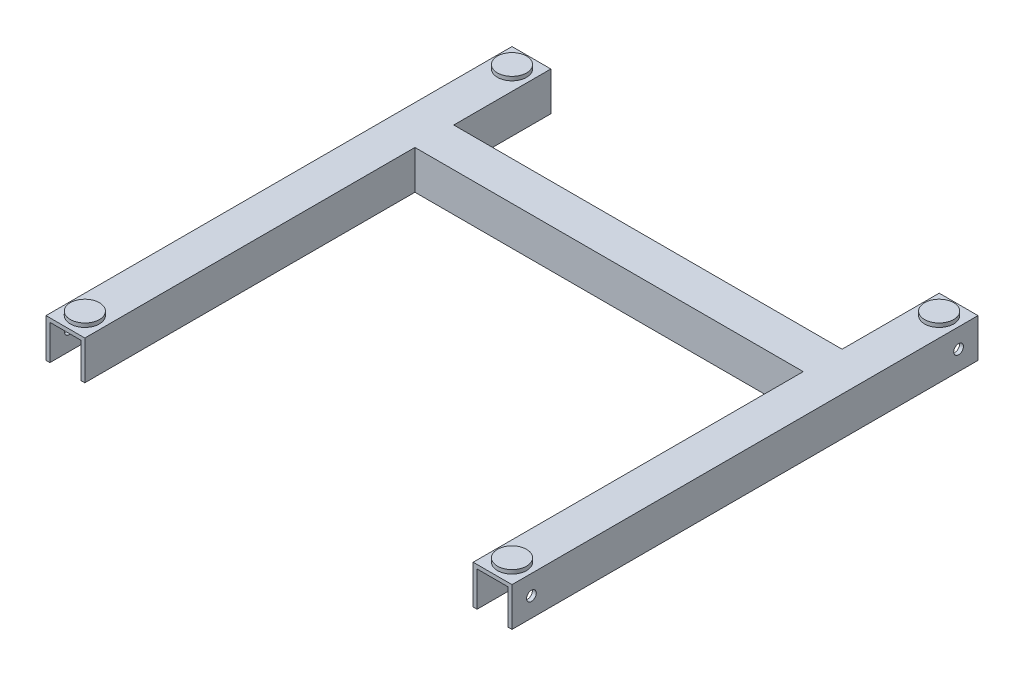
from build123d import *

# Parameters (mm, degrees)
SKETCH1_W           = 25.4
SKETCH1_H           = 304.8
BOSS_EXTRUDE1_DEPTH = 25.4
SKETCH2_W           = 20.32
SKETCH2_H           = 22.86
CUT_EXTRUDE1_DEPTH  = 307.909367729
SKETCH3_R           = 9.525
BOSS_EXTRUDE2_DEPTH = 2.54
SKETCH4_W           = 25.4
SKETCH4_H           = 25.4
BOSS_EXTRUDE3_DEPTH = 127
SKETCH5_W           = 20.32
SKETCH5_H           = 22.86
CUT_EXTRUDE2_DEPTH  = 127
SKETCH6_R           = 3.175
CUT_EXTRUDE3_DEPTH  = 12.7
CUT_EXTRUDE4_START  = -12.7
SKETCH7_R           = 3.175
CUT_EXTRUDE4_DEPTH  = 12.7


with BuildPart() as part:
    # Sketch1 → Boss-Extrude1 (new body)
    with BuildSketch(Plane(origin=(0, 0, 0), x_dir=(1, 0, 0), z_dir=(0, 1, 0))):
        with Locations((12.7, 152.4)):
            Rectangle(SKETCH1_W, SKETCH1_H)
    extrude(amount=BOSS_EXTRUDE1_DEPTH)

    # Sketch2 → Cut-Extrude1 (cut, through all)
    with BuildSketch(Plane.XY):
        with Locations((12.7, 11.43)):
            Rectangle(SKETCH2_W, SKETCH2_H)
    extrude(amount=-CUT_EXTRUDE1_DEPTH, mode=Mode.SUBTRACT)

    # Sketch3 → Boss-Extrude2 (add)
    with BuildSketch(Plane(origin=(0, 25.4, 0), x_dir=(1, 0, 0), z_dir=(0, 1, 0))):
        with Locations(Location((12.7, 12.7, 0), (0, 0, 90))):
            Circle(SKETCH3_R)
        with Locations(Location((12.7, 292.1, 0), (0, 0, 90))):
            Circle(SKETCH3_R)
    extrude(amount=BOSS_EXTRUDE2_DEPTH)

    # Sketch4 → Boss-Extrude3 (add)
    with BuildSketch(Plane(origin=(25.4, 0, 0), x_dir=(0, 0, -1), z_dir=(1, 0, 0))):
        with Locations((228.6, 12.7)):
            Rectangle(SKETCH4_W, SKETCH4_H)
    extrude(amount=BOSS_EXTRUDE3_DEPTH)

    # Sketch5 → Cut-Extrude2 (cut)
    with BuildSketch(Plane(origin=(152.4, 0, 0), x_dir=(0, 0, -1), z_dir=(1, 0, 0))):
        with Locations((228.6, 11.43)):
            Rectangle(SKETCH5_W, SKETCH5_H)
    extrude(amount=-CUT_EXTRUDE2_DEPTH, mode=Mode.SUBTRACT)

    # Mirror5: part across plane


with BuildPart() as part_1:
    add(part.part)
    add(part.part.mirror(Plane.ZY.offset(-152.4)))

    # Sketch6 → Cut-Extrude3 (cut)
    with BuildSketch(Plane(origin=(304.8, 0, 0), x_dir=(0, 0, -1), z_dir=(1, 0, 0))):
        with Locations((12.7, 12.7)):
            Circle(SKETCH6_R)
        with Locations((292.1, 12.7)):
            Circle(SKETCH6_R)
    extrude(amount=-CUT_EXTRUDE3_DEPTH, mode=Mode.SUBTRACT)

    # Sketch7 → Cut-Extrude4 (cut)
    with BuildSketch(Plane.ZY.offset(CUT_EXTRUDE4_START)):
        with Locations(Location((-292.1, 12.7, 0), (0, 0, 180))):
            Circle(SKETCH7_R)
        with Locations(Location((-12.7, 12.7, 0), (0, 0, 180))):
            Circle(SKETCH7_R)
    extrude(amount=CUT_EXTRUDE4_DEPTH, mode=Mode.SUBTRACT)


solid = part_1.part
